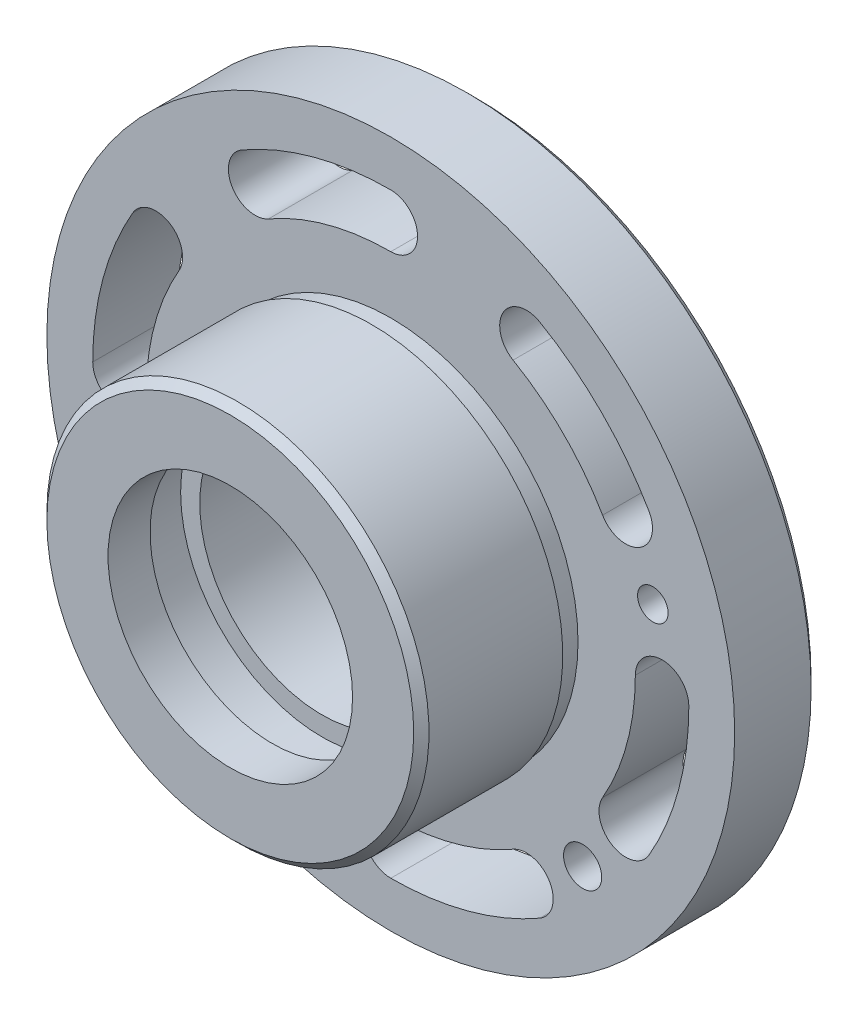
from build123d import *

# Parameters (mm, degrees)
SKETCH_1_R               = 90
EXTRUDE_1_DEPTH          = 22
SKETCH_2_R               = 50
EXTRUDE_2_DEPTH          = 42
SKETCH_3_OUTSIDE_W       = 234.496
SKETCH_3_OUTSIDE_H       = 234.496
SKETCH_3_OUTSIDE_R       = 49
CUT_EXTRUDE_1_DEPTH      = 5
SKETCH_4_R               = 32
CUT_EXTRUDE_2_DEPTH      = 143.464030548
CUT_EXTRUDE_START        = -24
SKETCH_5_R               = 37
CUT_EXTRUDE_3_DEPTH      = 13
SKETCH_6_R               = 52
CUT_EXTRUDE_4_DEPTH      = 6
CHAMFER_1_SIZE           = 2
CUT_EXTRUDE_5_DEPTH      = 135.029847422
PATTERN_CIRCULAR_1_COUNT = 6
F_10_0MM_2_D             = 10
F_8_0MM_1_D              = 8


with BuildPart() as part:
    # 草图1 → 凸台-拉伸1 (new body)
    with BuildSketch(Plane.XY):
        Circle(SKETCH_1_R)
    extrude(amount=EXTRUDE_1_DEPTH)

    # 草图2 → 凸台-拉伸2 (add)
    with BuildSketch(Plane.XY.offset(22)):
        with Locations(Location((0, 0, 0), (0, 0, 180))):
            Circle(SKETCH_2_R)
    extrude(amount=EXTRUDE_2_DEPTH)

    # 草图3 outside → 切除-拉伸1 (cut)
    with BuildSketch(Plane.XY.offset(22)):
        Rectangle(SKETCH_3_OUTSIDE_W, SKETCH_3_OUTSIDE_H)
        Circle(SKETCH_3_OUTSIDE_R, mode=Mode.SUBTRACT)
    extrude(amount=CUT_EXTRUDE_1_DEPTH, mode=Mode.SUBTRACT)

    # 草图4 → 切除-拉伸2 (cut, through all)
    with BuildSketch(Plane.XY.offset(64)):
        Circle(SKETCH_4_R)
    extrude(amount=-CUT_EXTRUDE_2_DEPTH, mode=Mode.SUBTRACT)

    # 草图5 → 切除-拉伸3 (cut)
    with BuildSketch(Plane.XY.offset(64).offset(CUT_EXTRUDE_START)):
        with Locations(Location((0, 0, 0), (0, 0, 180))):
            Circle(SKETCH_5_R)
    extrude(amount=CUT_EXTRUDE_3_DEPTH, mode=Mode.SUBTRACT)

    # 草图6 → 切除-拉伸4 (cut)
    with BuildSketch(Plane(origin=(0, 0, 0), x_dir=(-1, 0, 0), z_dir=(0, 0, -1))):
        Circle(SKETCH_6_R)
    extrude(amount=-CUT_EXTRUDE_4_DEPTH, mode=Mode.SUBTRACT)

    # 倒角1
    chamfer_1_edges = [part.edges().sort_by_distance(p)[0] for p in [
        (-90, 0, 0),
        (-32, 0, 6),
        (50, 0, 64),
    ]]
    chamfer(chamfer_1_edges, length=CHAMFER_1_SIZE)

    # 草图7 → 切除-拉伸5 (cut, through all)
    with BuildSketch(Plane.XY.offset(22)):
        with BuildLine():
            ThreePointArc((0, 78), (-20.187885518, 75.342214451), (-39, 67.549981495))
            ThreePointArc((-39, 67.549981495), (-41.562177826, 57.987803669), (-32, 55.425625842))
            ThreePointArc((-32, 55.425625842), (-16.564418887, 61.819252883), (0, 64))
            ThreePointArc((0, 64), (7, 71), (0, 78))
        make_face()
    cut_extrude_5 = extrude(amount=-CUT_EXTRUDE_5_DEPTH, mode=Mode.SUBTRACT)

    # 阵列(圆周)1: 切除-拉伸5 ×6 about axis
    pattern_circular_1_axis = Axis((0, 0, 0), (0, 0, 1))
    for i in range(1, PATTERN_CIRCULAR_1_COUNT):
        add(cut_extrude_5.rotate(pattern_circular_1_axis, i * 360 / PATTERN_CIRCULAR_1_COUNT), mode=Mode.SUBTRACT)

    # Ø10.0mm 暗销孔2 (through all)
    with Locations(Plane.XY.offset(22)):
        with Locations((50.204581464, -50.204581464)):
            Hole(F_10_0MM_2_D / 2)

    # Ø8.0mm 暗销孔1 (through all)
    with Locations(Plane.XY.offset(22)):
        with Locations((68.580733667, 18.376152202)):
            Hole(F_8_0MM_1_D / 2)


solid = part.part
